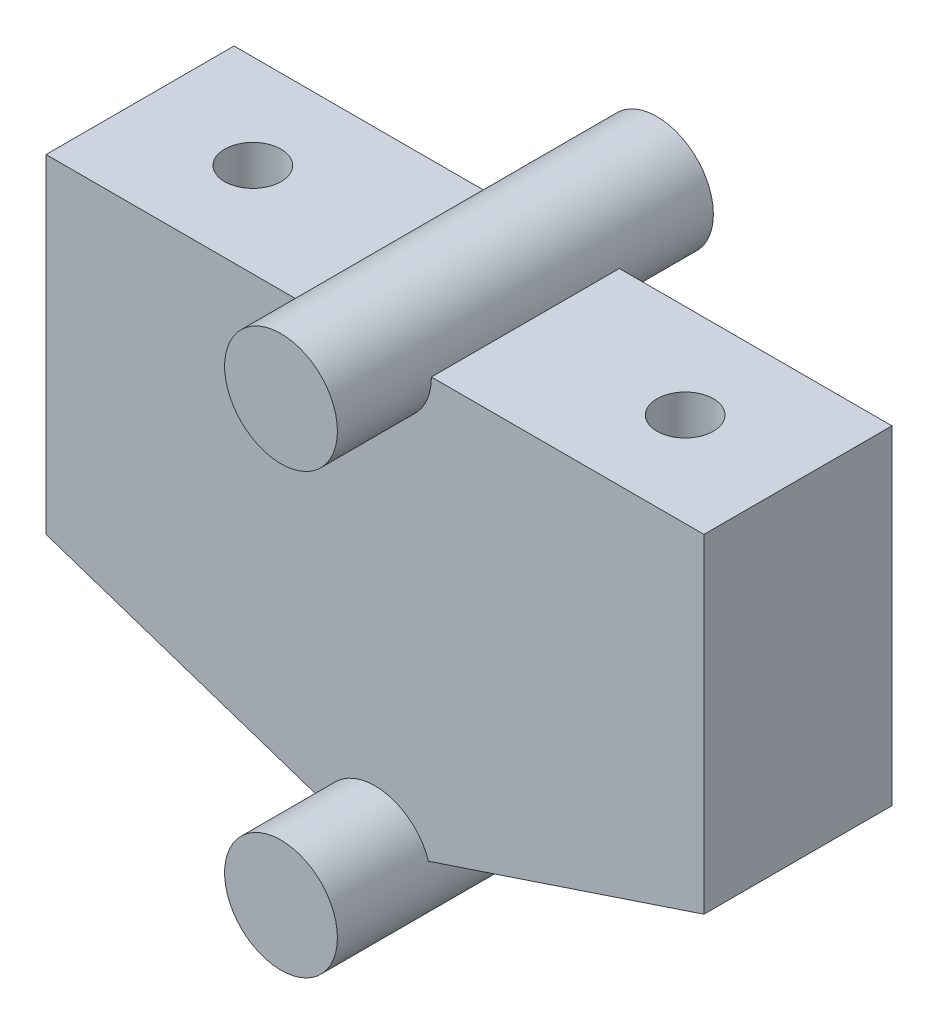
from build123d import *

# Parameters (mm, degrees)
BOSS_EXTRUDE1_DEPTH      = 10
BOSS_EXTRUDE2_DEPTH      = 15
BOSS_EXTRUDE2_DEPTH_BACK = 5
SKETCH2_R                = 1.5
CUT_EXTRUDE1_DEPTH       = 35.995634648
BOSS_EXTRUDE3_DEPTH      = 5
BOSS_EXTRUDE3_DEPTH_BACK = 15
SKETCH3_R                = 3


with BuildPart() as part:
    # Sketch1 → Boss-Extrude1 (new body)
    with BuildSketch(Plane.XY):
        with BuildLine():
            Line((-17.5, 8.75), (-17.5, -8.75))
            Line((-17.5, -8.75), (-2.846049894, -13.634650035))
            ThreePointArc((-2.846049894, -13.634650035), (0, -11.583333333), (2.846049894, -13.634650035))
            Line((2.846049894, -13.634650035), (17.5, -8.75))
            Line((17.5, -8.75), (17.5, 8.75))
            Line((17.5, 8.75), (-17.5, 8.75))
        make_face()
    extrude(amount=BOSS_EXTRUDE1_DEPTH)

    # Sketch1<3> → Boss-Extrude2 (add, two sides: drawn at the far end of the back side and taken through both)
    with BuildSketch(Plane.XY.offset(-BOSS_EXTRUDE2_DEPTH_BACK)):
        with BuildLine():
            ThreePointArc((2.846049894, -13.634650035), (0, -11.583333333), (-2.846049894, -13.634650035))
            ThreePointArc((-2.846049894, -13.634650035), (-0.480546729, -17.544595706), (3, -14.583333333))
            ThreePointArc((3, -14.583333333), (2.961262373, -14.102786604), (2.846049894, -13.634650035))
        make_face()
    extrude(amount=BOSS_EXTRUDE2_DEPTH + BOSS_EXTRUDE2_DEPTH_BACK)

    # Sketch2 → Cut-Extrude1 (cut, through all)
    with BuildSketch(Plane(origin=(0, 8.75, 0), x_dir=(1, 0, 0), z_dir=(0, 1, 0))):
        with Locations((-11.5, -5)):
            Circle(SKETCH2_R)
        with Locations((11.5, -5)):
            Circle(SKETCH2_R)
    extrude(amount=-CUT_EXTRUDE1_DEPTH, mode=Mode.SUBTRACT)

    # Sketch3 → Boss-Extrude3 (add, two sides: drawn at the far end of the back side and taken through both)
    with BuildSketch(Plane.XY.offset(10).offset(-BOSS_EXTRUDE3_DEPTH_BACK)):
        with Locations((0, 8.75)):
            Circle(SKETCH3_R)
    extrude(amount=BOSS_EXTRUDE3_DEPTH + BOSS_EXTRUDE3_DEPTH_BACK)


solid = part.part
